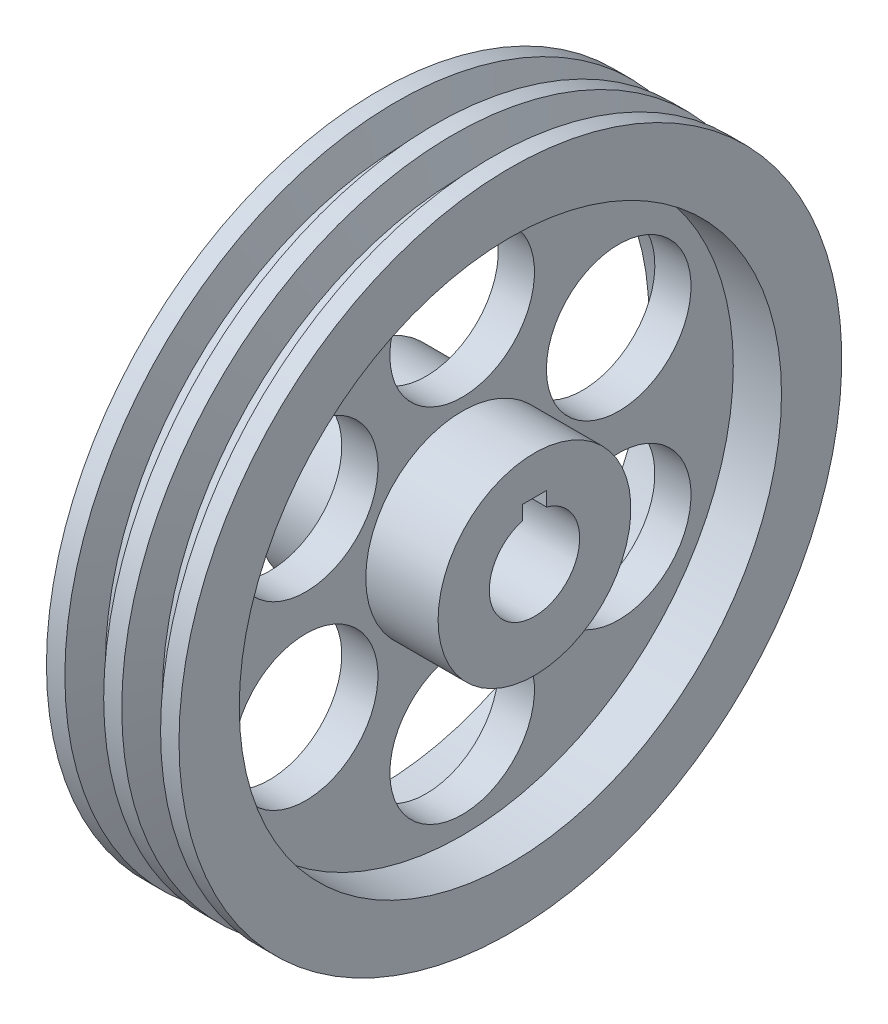
from build123d import *

# Parameters (mm, degrees)
SKETCH_6_W               = 4
SKETCH_6_H               = 9.6
CUT_EXTRUDE_4_DEPTH      = 84.366660003
SKETCH_7_R               = 12
CUT_EXTRUDE_7_DEPTH      = 80.837334625
PATTERN_CIRCULAR_2_COUNT = 6


with BuildPart() as part:
    # 草图5 → 旋转4 (revolve)
    with BuildSketch(Plane.XY):
        Polygon((-15.948135722, 7.5), (14.051864278, 7.5), (14.051864278, 16), (2.051864278, 16), (2.051864278, 45), (10.051864278, 45), (10.051864278, 55), (6.995140411, 55), (5.273502344, 50), (2.273502344, 50), (0.551864278, 55), (-2.448135722, 55), (-4.169773789, 50), (-7.169773789, 50), (-8.891411855, 55), (-11.948135722, 55), (-11.948135722, 45), (-3.948135722, 45), (-3.948135722, 16), (-15.948135722, 16), align=None)
    revolve(axis=Axis((-49.922793891, 0, 0), (1, 0, 0)))

    # 草图6 → 切除-拉伸4 (cut, through all)
    with BuildSketch(Plane(origin=(14.051864278, 0, 0), x_dir=(0, 0, -1), z_dir=(1, 0, 0))):
        with Locations((0, 4.8)):
            Rectangle(SKETCH_6_W, SKETCH_6_H)
    extrude(amount=-CUT_EXTRUDE_4_DEPTH, mode=Mode.SUBTRACT)

    # 草图7 → 切除-拉伸7 (cut, through all)
    with BuildSketch(Plane.ZY.offset(3.948135722)):
        with Locations((0, 30)):
            Circle(SKETCH_7_R)
    cut_extrude_7 = extrude(amount=-CUT_EXTRUDE_7_DEPTH, mode=Mode.SUBTRACT)

    # 阵列(圆周)2: 切除-拉伸7 ×6 about axis
    pattern_circular_2_axis = Axis((0, 0, 0), (-1, 0, 0))
    for i in range(1, PATTERN_CIRCULAR_2_COUNT):
        add(cut_extrude_7.rotate(pattern_circular_2_axis, i * 360 / PATTERN_CIRCULAR_2_COUNT), mode=Mode.SUBTRACT)


solid = part.part
